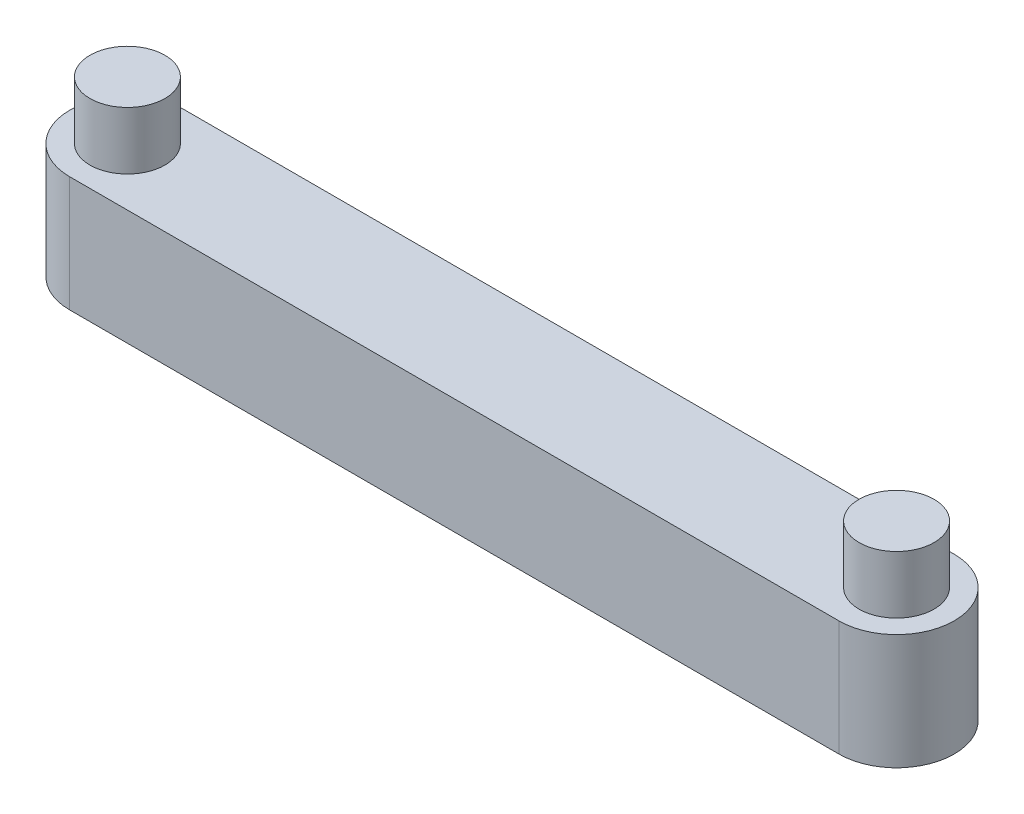
from build123d import *

# Parameters (mm, degrees)
BOSS_EXTRUDE1_DEPTH = 15
SKETCH2_R           = 9.75
CUT_EXTRUDE1_DEPTH  = 117.940155635
BOSS_EXTRUDE2_START = 30
SKETCH2_2_R         = 9.75
BOSS_EXTRUDE2_DEPTH = 30
SKETCH2_3_R         = 9.75
BOSS_EXTRUDE3_DEPTH = 3


with BuildPart() as part:
    # Sketch1 → Boss-Extrude1 (new, symmetric)
    with BuildSketch(Plane(origin=(0, 0, 0), x_dir=(1, 0, 0), z_dir=(0, 1, 0))):
        with BuildLine():
            Line((-100, 15), (100, 15))
            ThreePointArc((100, 15), (115, 0), (100, -15))
            Line((100, -15), (-100, -15))
            ThreePointArc((-100, -15), (-115, 0), (-100, 15))
        make_face()
    extrude(amount=BOSS_EXTRUDE1_DEPTH, both=True)

    # Sketch2 → Cut-Extrude1 (cut, through all)
    with BuildSketch(Plane(origin=(0, 0, 0), x_dir=(1, 0, 0), z_dir=(0, 1, 0))):
        with Locations((100, 0)):
            Circle(SKETCH2_R)
        with Locations((-100, 0)):
            Circle(SKETCH2_R)
    extrude(amount=-CUT_EXTRUDE1_DEPTH, mode=Mode.SUBTRACT)

    # Sketch2<2> → Boss-Extrude2 (add)
    with BuildSketch(Plane(origin=(0, 0, 0), x_dir=(1, 0, 0), z_dir=(0, 1, 0)).offset(BOSS_EXTRUDE2_START)):
        with Locations((100, 0)):
            Circle(SKETCH2_2_R)
        with Locations((-100, 0)):
            Circle(SKETCH2_2_R)
    extrude(amount=-BOSS_EXTRUDE2_DEPTH)

    # Sketch2<3> → Boss-Extrude3 (add)
    with BuildSketch(Plane(origin=(0, 0, 0), x_dir=(1, 0, 0), z_dir=(0, 1, 0))):
        with Locations((100, 0)):
            Circle(SKETCH2_3_R)
        with Locations((-100, 0)):
            Circle(SKETCH2_3_R)
    extrude(amount=-BOSS_EXTRUDE3_DEPTH)


solid = part.part
